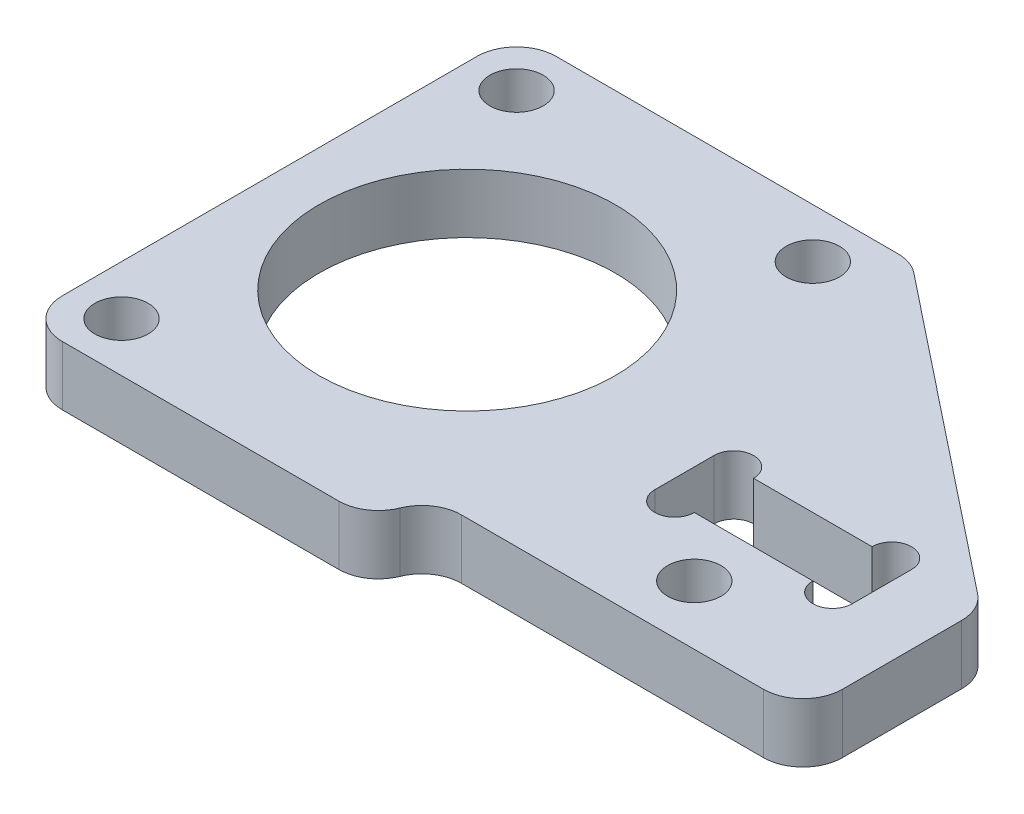
from build123d import *

# Parameters (mm, degrees)
SKETCH_1_R          = 7.5
EXTRUDE_1_DEPTH     = 3
SKETCH_3_R          = 1.35
CUT_EXTRUDE_1_DEPTH = 30.904013109
EXTRUDE_2_DEPTH     = 3
CUT_EXTRUDE_3_DEPTH = 30.904013109
FILLET_1_R          = 2
FILLET_2_R          = 2


with BuildPart() as part:
    # 草图1 → 凸台-拉伸1 (new body)
    with BuildSketch(Plane(origin=(0, 0, 0), x_dir=(1, 0, 0), z_dir=(0, 1, 0))):
        Polygon((-10, -12.5), (0, -12.5), (8, -12.5), (8, -10), (27, -10), (27, -4), (10, -4), (10, 12.5), (-10, 12.5), align=None)
        with Locations(Location((0, 0, 0), (0, 0, 270))):
            Circle(SKETCH_1_R, mode=Mode.SUBTRACT)
    extrude(amount=EXTRUDE_1_DEPTH)

    # 草图3 → 切除-拉伸1 (cut, through all)
    with BuildSketch(Plane(origin=(0, 3, 0), x_dir=(1, 0, 0), z_dir=(0, 1, 0))):
        with Locations(Location((18.5, -7, 0), (0, 0, 270))):
            Circle(SKETCH_3_R)
        with Locations(Location((-7.5, 10, 0), (0, 0, 270))):
            Circle(SKETCH_3_R)
        with Locations(Location((-7.5, -10, 0), (0, 0, 90))):
            Circle(SKETCH_3_R)
        with Locations(Location((7.5, 10, 0), (0, 0, 90))):
            Circle(SKETCH_3_R)
    extrude(amount=-CUT_EXTRUDE_1_DEPTH, mode=Mode.SUBTRACT)

    # 草图5 → 凸台-拉伸2 (add)
    with BuildSketch(Plane(origin=(0, 3, 0), x_dir=(1, 0, 0), z_dir=(0, 1, 0))):
        Polygon((23.5, -4), (27, -4), (27, -1), (10, 12.5), (10, -4), (13.5, -4), (13.5, -1), (23.5, -1), align=None)
    extrude(amount=-EXTRUDE_2_DEPTH)

    # 草图7 → 切除-拉伸3 (cut, through all)
    with BuildSketch(Plane(origin=(0, 3, 0), x_dir=(1, 0, 0), z_dir=(0, 1, 0))):
        with BuildLine():
            Line((23.5, -1), (21.5, -1))
            ThreePointArc((21.5, -1), (22.5, 0), (23.5, -1))
        make_face()
        with BuildLine():
            Line((13.5, -1), (15.5, -1))
            ThreePointArc((15.5, -1), (14.5, 0), (13.5, -1))
        make_face()
        with BuildLine():
            Line((13.5, -4), (15.5, -4))
            ThreePointArc((15.5, -4), (14.5, -5), (13.5, -4))
        make_face()
        with BuildLine():
            Line((23.5, -4), (21.5, -4))
            ThreePointArc((21.5, -4), (22.5, -5), (23.5, -4))
        make_face()
    extrude(amount=-CUT_EXTRUDE_3_DEPTH, mode=Mode.SUBTRACT)

    # 圆角1
    fillet_1_edges = [part.edges().sort_by_distance(p)[0] for p in [
        (27, 1.5, 10),
        (8, 1.5, 12.5),
        (-10, 1.5, 12.5),
        (-10, 1.5, -12.5),
    ]]
    fillet(fillet_1_edges, radius=FILLET_1_R)

    # 圆角2
    fillet_2_edges = [part.edges().sort_by_distance(p)[0] for p in [
        (8, 1.5, 10),
        (10, 1.5, -12.5),
        (27, 1.5, 1),
    ]]
    fillet(fillet_2_edges, radius=FILLET_2_R)


solid = part.part
